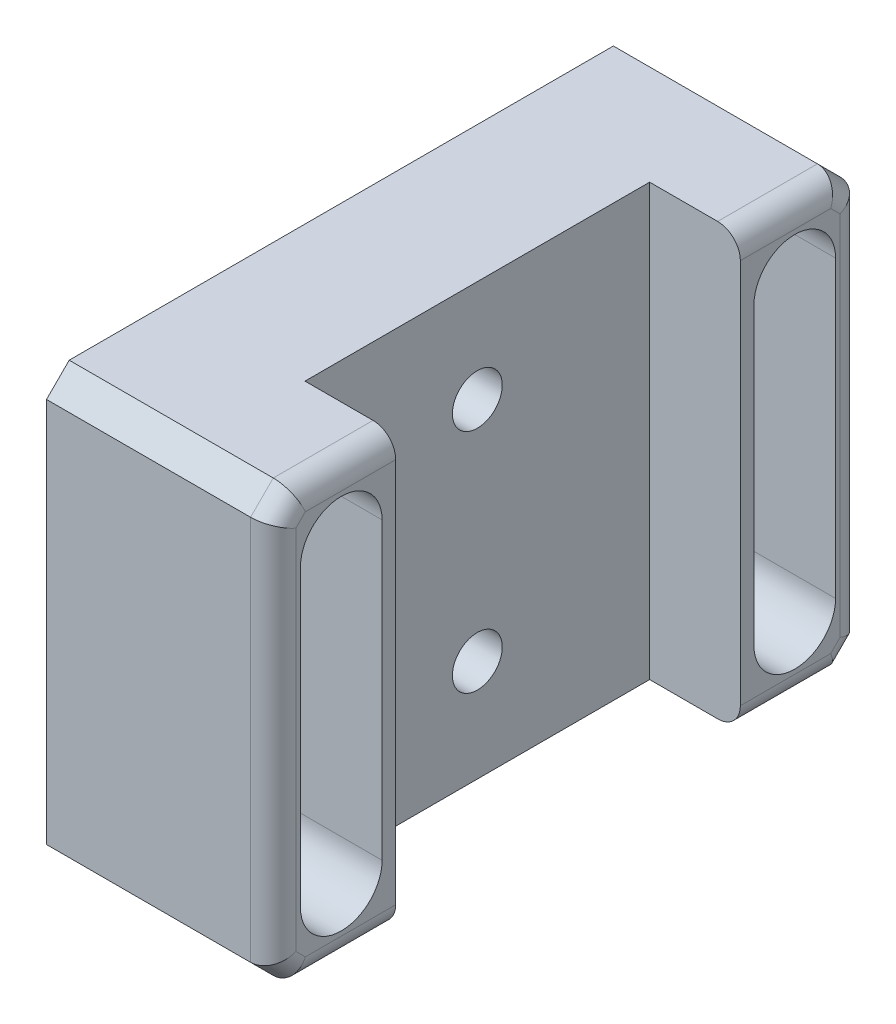
from build123d import *

# Parameters (mm, degrees)
SKETCH_1_W          = 26
SKETCH_1_H          = 19
EXTRUDE_1_DEPTH     = 10
SKETCH_2_W          = 15.2
SKETCH_2_H          = 19
CUT_EXTRUDE_1_DEPTH = 4
CUT_EXTRUDE_2_DEPTH = 4
CHAMFER_1_SIZE      = 1
FILLET_1_R          = 1
SKETCH_4_R          = 1.1
CUT_EXTRUDE_3_DEPTH = 18.182840277
CUT_EXTRUDE_4_DEPTH = 3


with BuildPart() as part:
    # Эскиз1 → Бобышка-Вытянуть1 (new body)
    with BuildSketch(Plane(origin=(0, 0, 0), x_dir=(0, 0, -1), z_dir=(1, 0, 0))):
        Rectangle(SKETCH_1_W, SKETCH_1_H)
        with BuildLine():
            Line((-8.9, 6.5), (-8.9, -6.5))
            ThreePointArc((-8.9, -6.5), (-10, -7.6), (-11.1, -6.5))
            Line((-11.1, -6.5), (-11.1, 6.5))
            ThreePointArc((-11.1, 6.5), (-10, 7.6), (-8.9, 6.5))
        make_face(mode=Mode.SUBTRACT)
        with BuildLine():
            Line((8.9, 6.5), (8.9, -6.5))
            ThreePointArc((8.9, -6.5), (10, -7.6), (11.1, -6.5))
            Line((11.1, -6.5), (11.1, 6.5))
            ThreePointArc((11.1, 6.5), (10, 7.6), (8.9, 6.5))
        make_face(mode=Mode.SUBTRACT)
    extrude(amount=EXTRUDE_1_DEPTH)

    # Эскиз2 → Вырез-Вытянуть1 (cut)
    with BuildSketch(Plane(origin=(10, 0, 0), x_dir=(0, 0, -1), z_dir=(1, 0, 0))):
        Rectangle(SKETCH_2_W, SKETCH_2_H)
    extrude(amount=-CUT_EXTRUDE_1_DEPTH, mode=Mode.SUBTRACT)

    # Эскиз3 → Вырез-Вытянуть2 (cut)
    with BuildSketch(Plane(origin=(10, 0, 0), x_dir=(0, 0, -1), z_dir=(1, 0, 0))):
        with BuildLine():
            Line((-11.8, -6.5), (-11.8, 6.5))
            ThreePointArc((-11.8, 6.5), (-10, 8.3), (-8.2, 6.5))
            Line((-8.2, 6.5), (-8.2, -6.5))
            ThreePointArc((-8.2, -6.5), (-10, -8.3), (-11.8, -6.5))
        make_face()
        with BuildLine():
            Line((11.8, -6.5), (11.8, 6.5))
            ThreePointArc((11.8, 6.5), (10, 8.3), (8.2, 6.5))
            Line((8.2, 6.5), (8.2, -6.5))
            ThreePointArc((8.2, -6.5), (10, -8.3), (11.8, -6.5))
        make_face()
    extrude(amount=-CUT_EXTRUDE_2_DEPTH, mode=Mode.SUBTRACT)

    # Фаска1
    chamfer_1_edges = [part.edges().sort_by_distance(p)[0] for p in [
        (5, -9.5, -13),
        (5, -9.5, 13),
        (5, 9.5, 13),
        (5, 9.5, -13),
    ]]
    chamfer(chamfer_1_edges, length=CHAMFER_1_SIZE)

    # Скругление1
    fillet_1_edges = [part.edges().sort_by_distance(p)[0] for p in [
        (10, 9.5, -9.8),
        (10, 0, -13),
        (10, -9, -12.5),
        (10, 9, -12.5),
        (10, -9.5, 9.8),
        (10, 0, 13),
        (10, 9, 12.5),
        (10, -9, 12.5),
        (10, -9.5, -9.8),
        (10, 9.5, 9.8),
    ]]
    fillet(fillet_1_edges, radius=FILLET_1_R)

    # Эскиз4 → Вырез-Вытянуть3 (cut, through all)
    with BuildSketch(Plane(origin=(6, 0, 0), x_dir=(0, 0, -1), z_dir=(1, 0, 0))):
        with Locations((0, 5)):
            Circle(SKETCH_4_R)
        with Locations(Location((0, -5, 0), (0, 0, 180))):
            Circle(SKETCH_4_R)
    extrude(amount=-CUT_EXTRUDE_3_DEPTH, mode=Mode.SUBTRACT)

    # Эскиз5 → Вырез-Вытянуть4 (cut)
    with BuildSketch(Plane.ZY):
        Polygon((1.125833025, 3.05), (2.25166605, 5), (1.125833025, 6.95), (-1.125833025, 6.95), (-2.25166605, 5), (-1.125833025, 3.05), align=None)
        Polygon((1.125833025, -6.95), (2.25166605, -5), (1.125833025, -3.05), (-1.125833025, -3.05), (-2.25166605, -5), (-1.125833025, -6.95), align=None)
    extrude(amount=-CUT_EXTRUDE_4_DEPTH, mode=Mode.SUBTRACT)


solid = part.part
